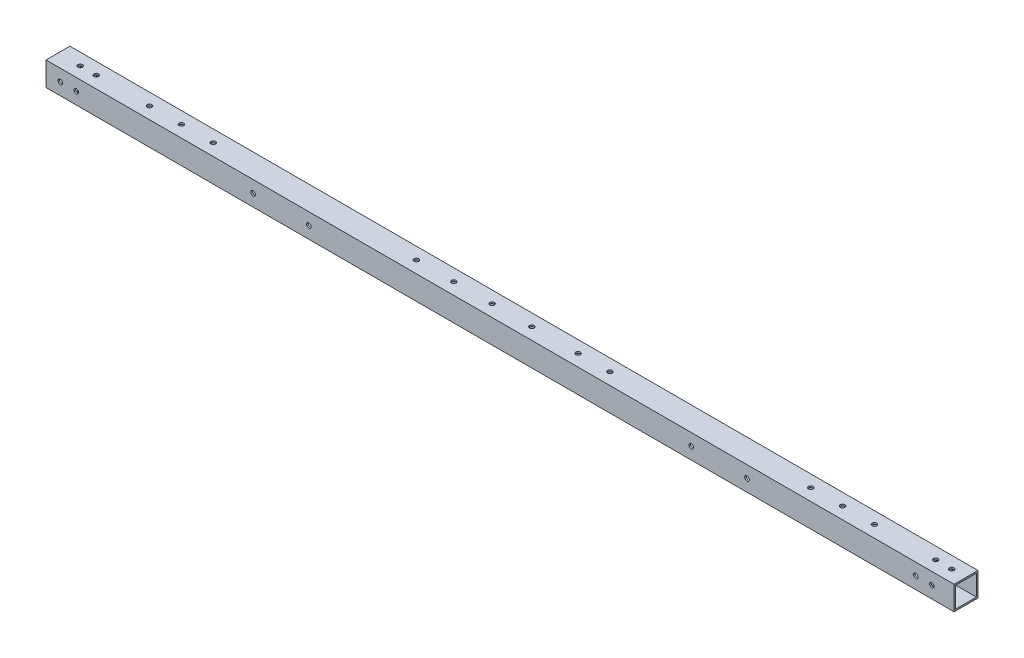
from build123d import *

# Parameters (mm, degrees)
SKETCH_1_W          = 15
SKETCH_1_H          = 15
SKETCH_1_W_2        = 13
SKETCH_1_H_2        = 13
EXTRUDE_1_DEPTH     = 570
SKETCH_2_R          = 1.45
CUT_EXTRUDE_1_DEPTH = 571.246657158
SKETCH_3_R          = 1.45
CUT_EXTRUDE_2_DEPTH = 571.246657158


with BuildPart() as part:
    # 草图1 → 凸台-拉伸1 (new body)
    with BuildSketch(Plane(origin=(0, 0, 0), x_dir=(0, 0, -1), z_dir=(1, 0, 0))):
        Rectangle(SKETCH_1_W, SKETCH_1_H)
        Rectangle(SKETCH_1_W_2, SKETCH_1_H_2, mode=Mode.SUBTRACT)
    extrude(amount=EXTRUDE_1_DEPTH)

    # 草图2 → 切除-拉伸1 (cut, through all)
    with BuildSketch(Plane(origin=(0, 7.5, 0), x_dir=(1, 0, 0), z_dir=(0, 1, 0))):
        with Locations(Location((561, 0, 0), (0, 0, 270))):
            Circle(SKETCH_2_R)
        with Locations(Location((551, 0, 0), (0, 0, 270))):
            Circle(SKETCH_2_R)
        with Locations(Location((297.5, 0, 0), (0, 0, 270))):
            Circle(SKETCH_2_R)
        with Locations(Location((272.5, 0, 0), (0, 0, 270))):
            Circle(SKETCH_2_R)
        with Locations(Location((24, 0, 0), (0, 0, 270))):
            Circle(SKETCH_2_R)
        with Locations(Location((14, 0, 0), (0, 0, 270))):
            Circle(SKETCH_2_R)
        with Locations(Location((97.5, 0, 0), (0, 0, 270))):
            Circle(SKETCH_2_R)
        with Locations(Location((77.5, 0, 0), (0, 0, 270))):
            Circle(SKETCH_2_R)
        with Locations(Location((57.5, 0, 0), (0, 0, 270))):
            Circle(SKETCH_2_R)
        with Locations(Location((472.5, 0, 0), (0, 0, 270))):
            Circle(SKETCH_2_R)
        with Locations(Location((492.5, 0, 0), (0, 0, 270))):
            Circle(SKETCH_2_R)
        with Locations(Location((512.5, 0, 0), (0, 0, 270))):
            Circle(SKETCH_2_R)
        with Locations(Location((346.5, 0, 0), (0, 0, 270))):
            Circle(SKETCH_2_R)
        with Locations(Location((326.5, 0, 0), (0, 0, 270))):
            Circle(SKETCH_2_R)
        with Locations(Location((248.5, 0, 0), (0, 0, 270))):
            Circle(SKETCH_2_R)
        with Locations(Location((225, 0, 0), (0, 0, 270))):
            Circle(SKETCH_2_R)
    extrude(amount=-CUT_EXTRUDE_1_DEPTH, mode=Mode.SUBTRACT)

    # 草图3 → 切除-拉伸2 (cut, through all)
    with BuildSketch(Plane.XY.offset(7.5)):
        with Locations((440, 0)):
            Circle(SKETCH_3_R)
        with Locations((405, 0)):
            Circle(SKETCH_3_R)
        with Locations((165, 0)):
            Circle(SKETCH_3_R)
        with Locations((130, 0)):
            Circle(SKETCH_3_R)
        with Locations((19, 0)):
            Circle(SKETCH_3_R)
        with Locations((9, 0)):
            Circle(SKETCH_3_R)
        with Locations((556, 0)):
            Circle(SKETCH_3_R)
        with Locations((546, 0)):
            Circle(SKETCH_3_R)
    extrude(amount=-CUT_EXTRUDE_2_DEPTH, mode=Mode.SUBTRACT)


solid = part.part
